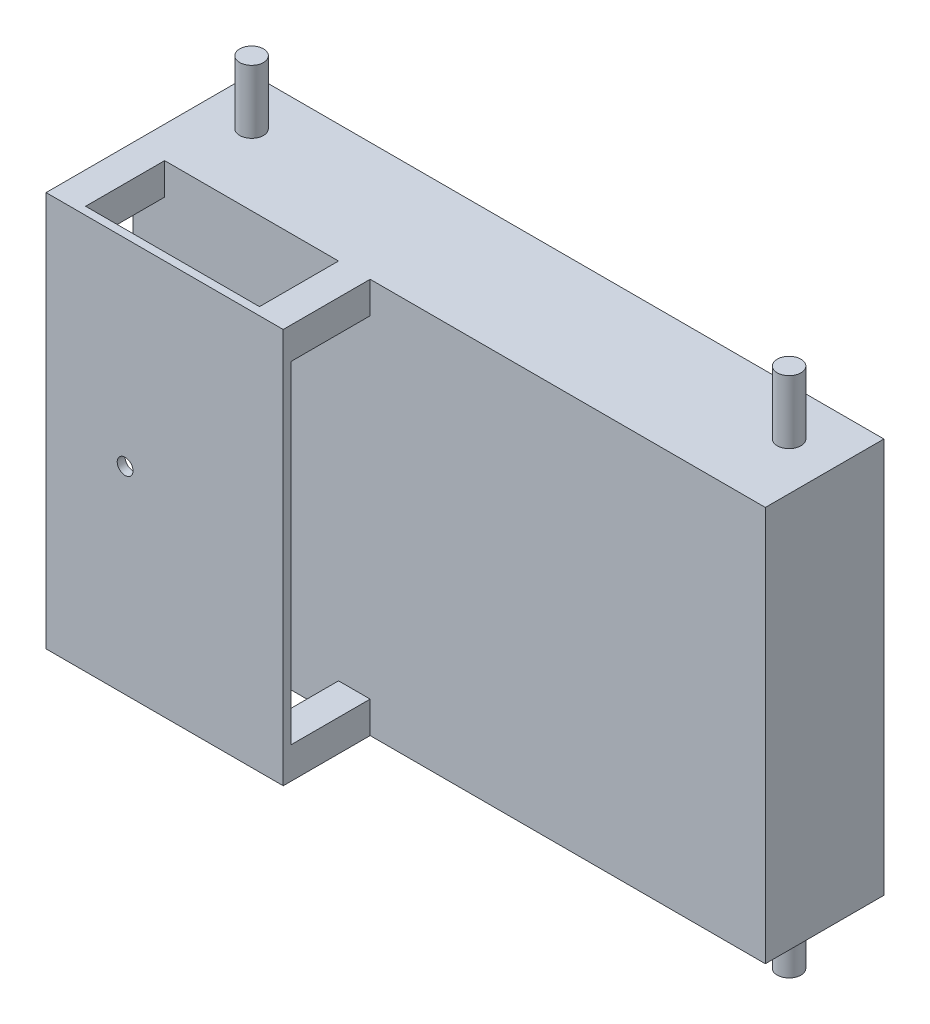
from build123d import *

# Parameters (mm, degrees)
SKETCH1_W           = 400
SKETCH1_H           = 250
BOSS_EXTRUDE1_DEPTH = 5
SKETCH2_W           = 20
SKETCH2_H           = 20
SKETCH2_W_2         = 16
SKETCH2_H_2         = 16
BOSS_EXTRUDE3_DEPTH = 50
SKETCH3_W           = 150
SKETCH3_H           = 250
BOSS_EXTRUDE4_DEPTH = 5
SKETCH4_R           = 5
CUT_EXTRUDE1_DEPTH  = 5
SKETCH5_W           = 400
SKETCH5_H           = 250
SKETCH5_W_2         = 390
SKETCH5_H_2         = 240
BOSS_EXTRUDE5_DEPTH = 70
SKETCH6_W           = 400
SKETCH6_H           = 250
BOSS_EXTRUDE6_DEPTH = 5
SKETCH7_R           = 7.5
BOSS_EXTRUDE7_DEPTH = 40
BOSS_EXTRUDE8_START = 40
SKETCH8_R           = 7.5
BOSS_EXTRUDE8_DEPTH = 40


with BuildPart() as part:
    # Sketch1 → Boss-Extrude1 (new body)
    with BuildSketch(Plane.XY):
        with Locations((200, -125)):
            Rectangle(SKETCH1_W, SKETCH1_H)
    extrude(amount=BOSS_EXTRUDE1_DEPTH)

    # Sketch2 → Boss-Extrude3 (add)
    # profile 1 of 4: a face of its own
    with BuildSketch(Plane.XY.offset(5)):
        with Locations((10, -240)):
            Rectangle(SKETCH2_W, SKETCH2_H)
        with Locations((10, -240)):
            Rectangle(SKETCH2_W_2, SKETCH2_H_2, mode=Mode.SUBTRACT)
    # profile 2 of 4: a face of its own
    with BuildSketch(Plane.XY.offset(5)):
        with Locations((140, -240)):
            Rectangle(SKETCH2_W, SKETCH2_H)
        with Locations((140, -240)):
            Rectangle(SKETCH2_W_2, SKETCH2_H_2, mode=Mode.SUBTRACT)
    # profile 3 of 4: a face of its own
    with BuildSketch(Plane.XY.offset(5)):
        with Locations((10, -10)):
            Rectangle(SKETCH2_W, SKETCH2_H)
        with Locations((10, -10)):
            Rectangle(SKETCH2_W_2, SKETCH2_H_2, mode=Mode.SUBTRACT)
    # profile 4 of 4: a face of its own
    with BuildSketch(Plane.XY.offset(5)):
        with Locations((140, -10)):
            Rectangle(SKETCH2_W, SKETCH2_H)
        with Locations((140, -10)):
            Rectangle(SKETCH2_W_2, SKETCH2_H_2, mode=Mode.SUBTRACT)
    extrude(amount=BOSS_EXTRUDE3_DEPTH)

    # Sketch3 → Boss-Extrude4 (add)
    with BuildSketch(Plane.XY.offset(55)):
        with Locations((75, -125)):
            Rectangle(SKETCH3_W, SKETCH3_H)
    extrude(amount=BOSS_EXTRUDE4_DEPTH)

    # Sketch4 → Cut-Extrude1 (cut)
    with BuildSketch(Plane.XY.offset(60)):
        with Locations((50, -125)):
            Circle(SKETCH4_R)
    extrude(amount=-CUT_EXTRUDE1_DEPTH, mode=Mode.SUBTRACT)

    # Sketch5 → Boss-Extrude5 (add)
    with BuildSketch(Plane(origin=(0, 0, 0), x_dir=(-1, 0, 0), z_dir=(0, 0, -1))):
        with Locations((-200, -125)):
            Rectangle(SKETCH5_W, SKETCH5_H)
        with Locations((-200, -125)):
            Rectangle(SKETCH5_W_2, SKETCH5_H_2, mode=Mode.SUBTRACT)
    extrude(amount=BOSS_EXTRUDE5_DEPTH)

    # Sketch6 → Boss-Extrude6 (add)
    with BuildSketch(Plane(origin=(0, 0, -70), x_dir=(-1, 0, 0), z_dir=(0, 0, -1))):
        with Locations((-200, -125)):
            Rectangle(SKETCH6_W, SKETCH6_H)
    extrude(amount=-BOSS_EXTRUDE6_DEPTH)

    # Sketch7 → Boss-Extrude7 (add)
    with BuildSketch(Plane.XZ.offset(250)):
        with Locations(Location((30, -40, 0), (0, 0, 90))):
            Circle(SKETCH7_R)
        with Locations(Location((370, -40, 0), (0, 0, 90))):
            Circle(SKETCH7_R)
    extrude(amount=BOSS_EXTRUDE7_DEPTH)

    # Sketch8 → Boss-Extrude8 (add)
    with BuildSketch(Plane(origin=(0, 0, 0), x_dir=(1, 0, 0), z_dir=(0, 1, 0)).offset(BOSS_EXTRUDE8_START)):
        with Locations(Location((370, 40, 0), (0, 0, 270))):
            Circle(SKETCH8_R)
        with Locations(Location((30, 40, 0), (0, 0, 270))):
            Circle(SKETCH8_R)
    extrude(amount=-BOSS_EXTRUDE8_DEPTH)


solid = part.part
